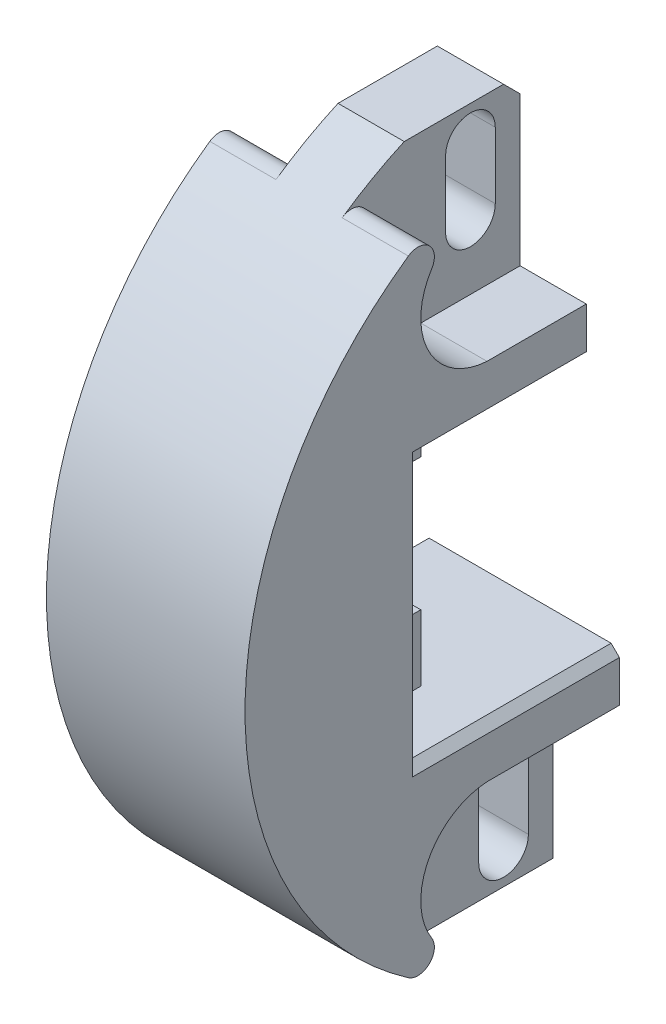
from build123d import *

# Parameters (mm, degrees)
BOSS_EXTRUDE1_DEPTH     = 6
CHAMFER1_SIZE           = 0.5
CHAMFER2_SIZE           = 0.5
SKETCH3_W               = 4
SKETCH3_H               = 4
BOSS_EXTRUDE2_DEPTH     = 2
CUT_EXTRUDE1_START      = 28.757553028
CUT_EXTRUDE1_DEPTH      = 32.757553028
CHAMFER3_SIZE           = 1
CUT_EXTRUDE2_DEPTH      = 27.277019429
CUT_EXTRUDE2_DEPTH_BACK = 27.277019429
CUT_EXTRUDE3_DEPTH      = 27.277019429
CUT_EXTRUDE3_DEPTH_BACK = 27.277019429


with BuildPart() as part:
    # Sketch1 → Boss-Extrude1 (new, symmetric)
    with BuildSketch(Plane.YZ):
        with BuildLine():
            Line((-21, 0), (-21, -9))
            Line((-21, -9), (-8, -9))
            Line((-8, -9), (-8, 3))
            Line((-8, 3), (8, 3))
            Line((8, 3), (8, -7))
            Line((8, -7), (21, -7))
            Line((21, -7), (21, 0))
            ThreePointArc((21, 0), (0, 13.61916848), (-21, 0))
        make_face()
    extrude(amount=BOSS_EXTRUDE1_DEPTH, both=True)

    # Chamfer1
    chamfer1_edges = [part.edges().sort_by_distance(p)[0] for p in [
        (6, -8, -3),
        (6, 0, 3),
        (6, 8, -2),
    ]]
    chamfer(chamfer1_edges, length=CHAMFER1_SIZE)

    # Chamfer2
    chamfer2_edges = [part.edges().sort_by_distance(p)[0] for p in [
        (-6, -8, -3),
        (-6, 8, -2),
        (-6, 0, 3),
    ]]
    chamfer(chamfer2_edges, length=CHAMFER2_SIZE)

    # Sketch3 → Boss-Extrude2 (add, symmetric)
    with BuildSketch(Plane.YZ):
        with Locations((-6, 1)):
            Rectangle(SKETCH3_W, SKETCH3_H)
    boss_extrude2 = extrude(amount=BOSS_EXTRUDE2_DEPTH, both=True)

    # Mirror1: Boss-Extrude2 across plane
    add(boss_extrude2.mirror(Plane.ZX))

    # Sketch4 → Cut-Extrude1 (cut)
    with BuildSketch(Plane.YZ.offset(6).offset(CUT_EXTRUDE1_START)):
        with BuildLine():
            Line((-11, -9), (-11, -1))
            ThreePointArc((-11, -1), (-13.308790472, 2.534537402), (-17.525839358, 2.334620458))
            ThreePointArc((-17.525839358, 2.334620458), (-18.784311125, 2.485384213), (-18.884110874, 3.748919297))
            ThreePointArc((-18.884110874, 3.748919297), (-20.029956915, 1.924071221), (-21, 0))
            Line((-21, 0), (-21, -9))
            Line((-21, -9), (-11, -9))
        make_face()
        with BuildLine():
            Line((21, -7), (21, 0))
            ThreePointArc((21, 0), (20.029956915, 1.924071221), (18.884110874, 3.748919297))
            ThreePointArc((18.884110874, 3.748919297), (18.784311125, 2.485384213), (17.525839358, 2.334620458))
            ThreePointArc((17.525839358, 2.334620458), (13.308790472, 2.534537402), (11, -1))
            Line((11, -1), (11, -7))
            Line((11, -7), (21, -7))
        make_face()
    cut_extrude1 = extrude(amount=-CUT_EXTRUDE1_DEPTH, mode=Mode.SUBTRACT)

    # Mirror2: Cut-Extrude1 across plane
    add(cut_extrude1.mirror(Plane(origin=(0, 0, 0), x_dir=(0, 0, 1), z_dir=(1, 0, 0))), mode=Mode.SUBTRACT)

    # Chamfer3
    chamfer3_edges = [part.edges().sort_by_distance(p)[0] for p in [
        (0, 21, -7),
    ]]
    chamfer(chamfer3_edges, length=CHAMFER3_SIZE)

    # Sketch5 → Cut-Extrude2 (cut, two sides: drawn at the far end of the back side and taken through both)
    with BuildSketch(Plane.YZ.offset(2).offset(-CUT_EXTRUDE2_DEPTH_BACK)):
        with BuildLine():
            Line((-19, -4.5), (-15, -4.5))
            ThreePointArc((-15, -4.5), (-13.5, -6), (-15, -7.5))
            Line((-15, -7.5), (-19, -7.5))
            ThreePointArc((-19, -7.5), (-20.5, -6), (-19, -4.5))
        make_face()
    extrude(amount=CUT_EXTRUDE2_DEPTH + CUT_EXTRUDE2_DEPTH_BACK, mode=Mode.SUBTRACT)

    # Sketch6 → Cut-Extrude3 (cut, two sides: drawn at the far end of the back side and taken through both)
    with BuildSketch(Plane.YZ.offset(2).offset(-CUT_EXTRUDE3_DEPTH_BACK)):
        with BuildLine():
            Line((19, -5.5), (15, -5.5))
            ThreePointArc((15, -5.5), (13.5, -4), (15, -2.5))
            Line((15, -2.5), (19, -2.5))
            ThreePointArc((19, -2.5), (20.5, -4), (19, -5.5))
        make_face()
    extrude(amount=CUT_EXTRUDE3_DEPTH + CUT_EXTRUDE3_DEPTH_BACK, mode=Mode.SUBTRACT)


solid = part.part
